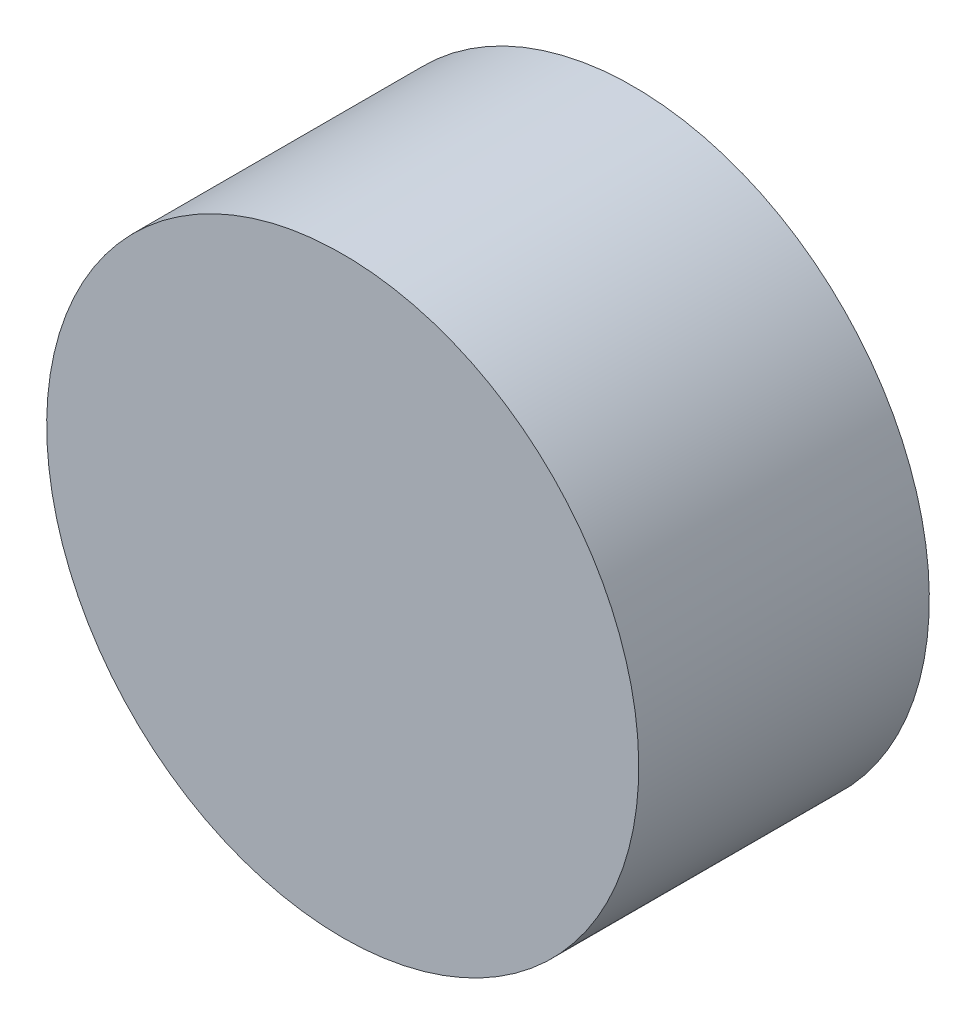
from build123d import *

# Parameters (mm, degrees)
SKETCH1_W = 32.82629413
SKETCH1_H = 32.22116744


with BuildPart() as part:
    # Sketch1 → Revolve1 (revolve)
    with BuildSketch(Plane.YZ):
        with Locations((-16.413147065, -16.11058372)):
            Rectangle(SKETCH1_W, SKETCH1_H)
    revolve(axis=Axis((0, 0, 0), (0, 0, -1)))


solid = part.part
